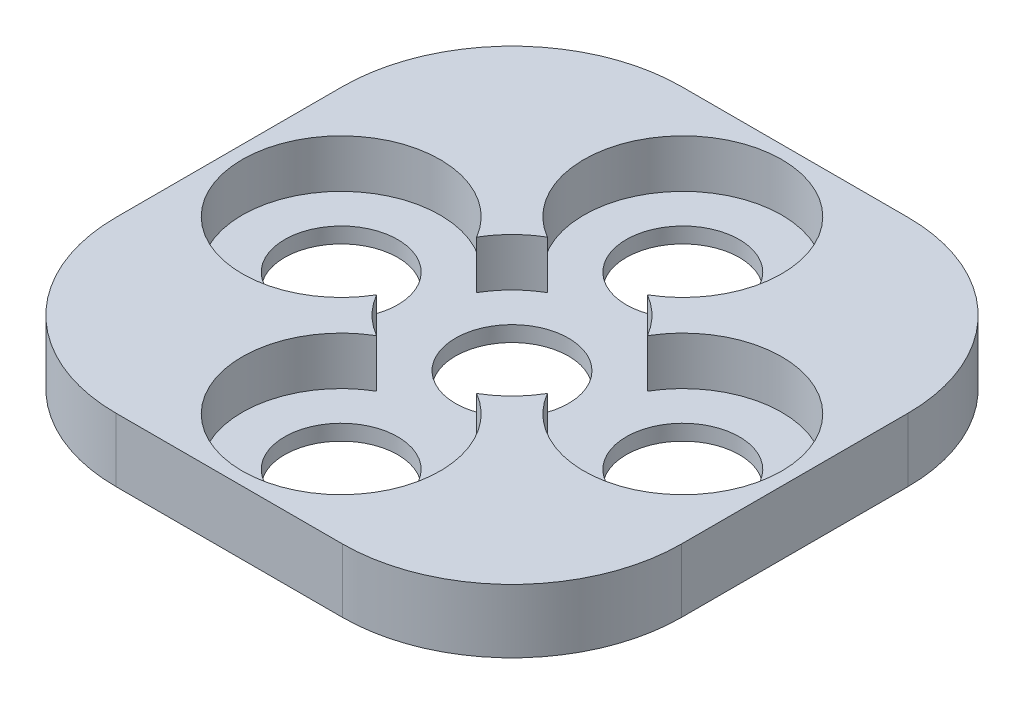
from build123d import *

# Parameters (mm, degrees)
SKETCH1_W           = 254
SKETCH1_H           = 254
BOSS_EXTRUDE1_DEPTH = 28.575
CUT_EXTRUDE1_DEPTH  = 21.59
SKETCH3_R           = 25.4
CUT_EXTRUDE2_DEPTH  = 16.51
FILLET1_R           = 76.2


with BuildPart() as part:
    # Sketch1 → Boss-Extrude1 (new body)
    with BuildSketch(Plane(origin=(0, 0, 0), x_dir=(1, 0, 0), z_dir=(0, 1, 0))):
        with Locations((127, 127)):
            Rectangle(SKETCH1_W, SKETCH1_H)
    extrude(amount=BOSS_EXTRUDE1_DEPTH)

    # Sketch2 → Cut-Extrude1 (cut)
    with BuildSketch(Plane(origin=(0, 28.575, 0), x_dir=(1, 0, 0), z_dir=(0, 1, 0))):
        with BuildLine():
            ThreePointArc((165.354, 104.532842102), (248.158, 127), (165.354, 149.467157898))
            ThreePointArc((165.354, 149.467157898), (158.430896424, 158.430896424), (149.467157898, 165.354))
            ThreePointArc((149.467157898, 165.354), (127, 248.158), (104.532842102, 165.354))
            ThreePointArc((104.532842102, 165.354), (95.569103576, 158.430896424), (88.646, 149.467157898))
            ThreePointArc((88.646, 149.467157898), (5.842, 127), (88.646, 104.532842102))
            ThreePointArc((88.646, 104.532842102), (95.569103576, 95.569103576), (104.532842102, 88.646))
            ThreePointArc((104.532842102, 88.646), (127, 5.842), (149.467157898, 88.646))
            ThreePointArc((149.467157898, 88.646), (158.430896424, 95.569103576), (165.354, 104.532842102))
        make_face()
    extrude(amount=-CUT_EXTRUDE1_DEPTH, mode=Mode.SUBTRACT)

    # Sketch3 → Cut-Extrude2 (cut)
    with BuildSketch(Plane(origin=(0, 6.985, 0), x_dir=(1, 0, 0), z_dir=(0, 1, 0))):
        with Locations(Location((127, 127, 0), (0, 0, 270))):
            Circle(SKETCH3_R)
        with Locations(Location((127, 50.292, 0), (0, 0, 270))):
            Circle(SKETCH3_R)
        with Locations(Location((50.292, 127, 0), (0, 0, 270))):
            Circle(SKETCH3_R)
        with Locations(Location((127, 203.708, 0), (0, 0, 270))):
            Circle(SKETCH3_R)
        with Locations(Location((203.708, 127, 0), (0, 0, 270))):
            Circle(SKETCH3_R)
    extrude(amount=-CUT_EXTRUDE2_DEPTH, mode=Mode.SUBTRACT)

    # Fillet1
    fillet1_edges = [part.edges().sort_by_distance(p)[0] for p in [
        (0, 14.2875, -254),
        (254, 14.2875, -254),
        (254, 14.2875, 0),
        (0, 14.2875, 0),
    ]]
    fillet(fillet1_edges, radius=FILLET1_R)


solid = part.part
